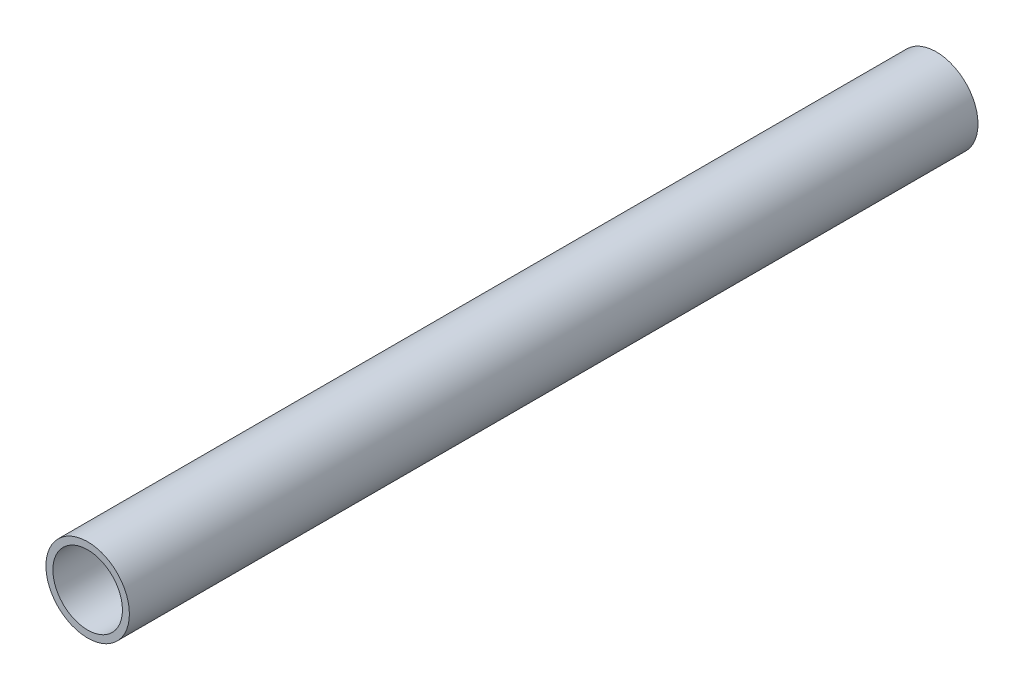
from build123d import *

# Parameters (mm, degrees)
SKETCH2_R           = 30
SKETCH2_R_2         = 25
BOSS_EXTRUDE1_DEPTH = 610


with BuildPart() as part:
    # Sketch2 → Boss-Extrude1 (new body)
    with BuildSketch(Plane.XY):
        Circle(SKETCH2_R)
        Circle(SKETCH2_R_2, mode=Mode.SUBTRACT)
    extrude(amount=-BOSS_EXTRUDE1_DEPTH)


solid = part.part
